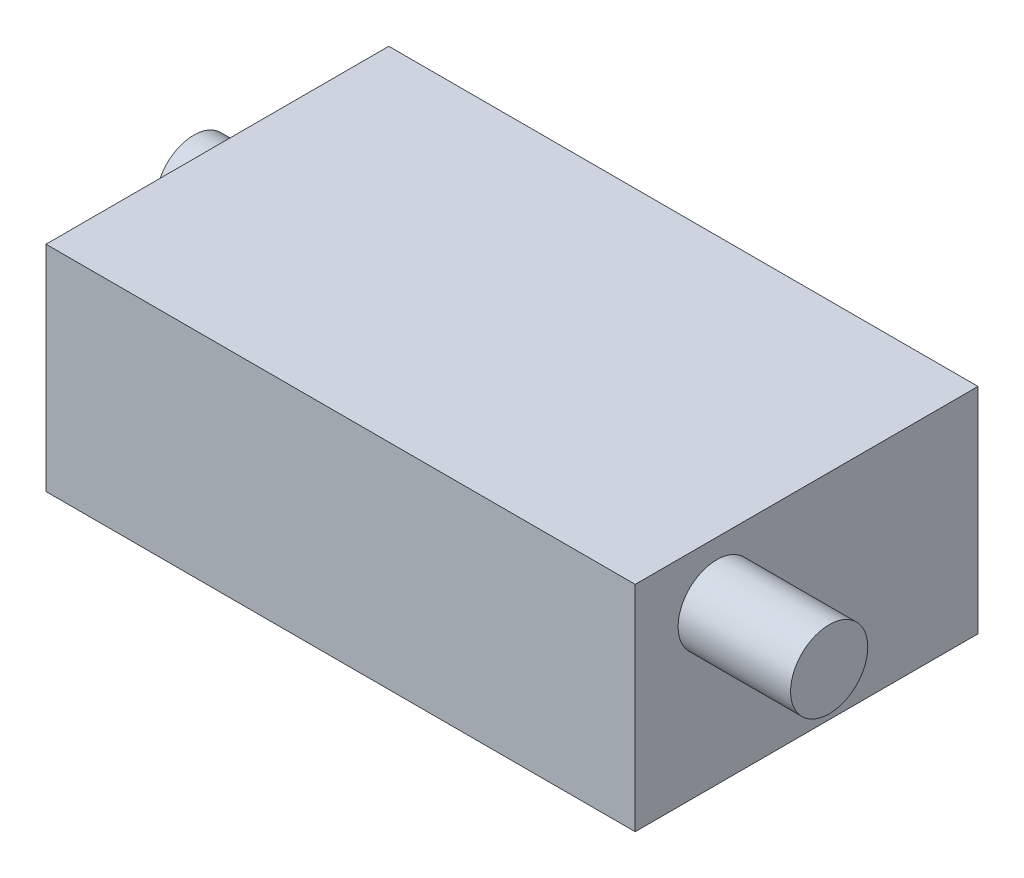
from build123d import *

# Parameters (mm, degrees)
SKETCH1_W           = 60.96
SKETCH1_H           = 38.1
BOSS_EXTRUDE1_DEPTH = 104.775
SKETCH3_R           = 6.732897925
BOSS_EXTRUDE2_DEPTH = 20.0025
SKETCH2_R           = 6.865425502
BOSS_EXTRUDE3_DEPTH = 20.0025


with BuildPart() as part:
    # Sketch1 → Boss-Extrude1 (new body)
    with BuildSketch(Plane(origin=(0, 0, 0), x_dir=(0, 0, -1), z_dir=(1, 0, 0))):
        with Locations((30.48, 19.05)):
            Rectangle(SKETCH1_W, SKETCH1_H)
    extrude(amount=BOSS_EXTRUDE1_DEPTH)

    # Sketch3 → Boss-Extrude2 (add)
    with BuildSketch(Plane.ZY):
        with Locations((-46.280983346, 15.027703104)):
            Circle(SKETCH3_R)
    extrude(amount=BOSS_EXTRUDE2_DEPTH)

    # Sketch2 → Boss-Extrude3 (add)
    with BuildSketch(Plane(origin=(104.775, 0, 0), x_dir=(0, 0, -1), z_dir=(1, 0, 0))):
        with Locations(Location((14.493127779, 27.778848981, 0), (0, 0, 180))):
            Circle(SKETCH2_R)
    extrude(amount=BOSS_EXTRUDE3_DEPTH)


solid = part.part
